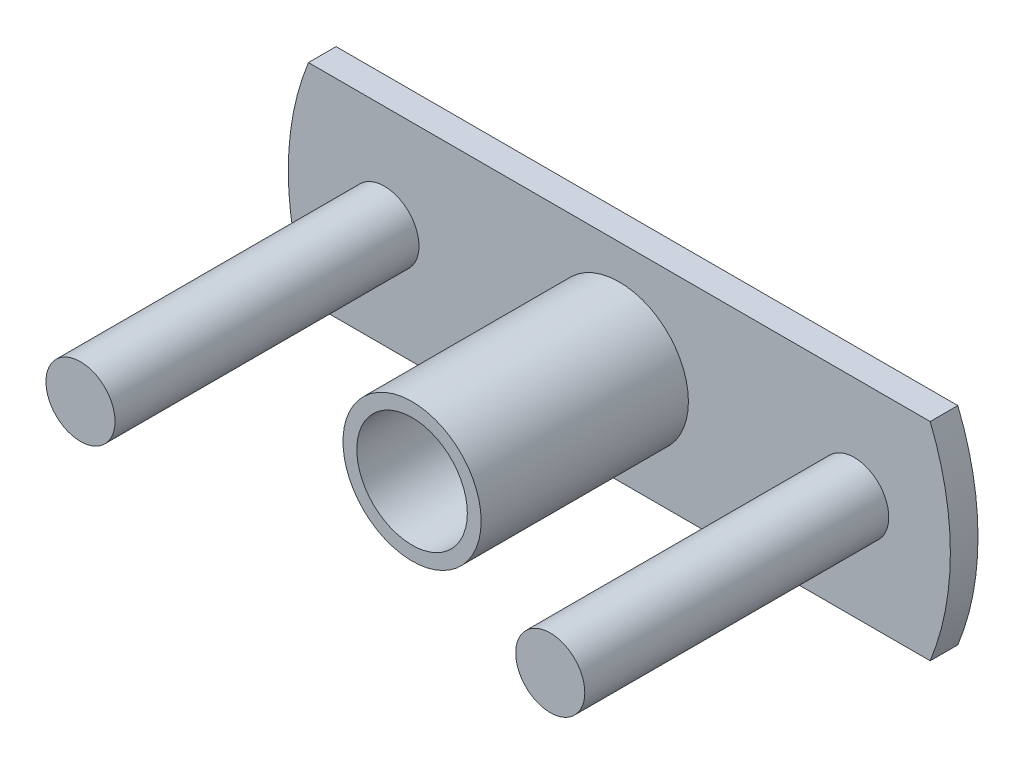
from build123d import *

# Parameters (mm, degrees)
BOSS_EXTRUDE1_DEPTH = 2
SKETCH2_R           = 5
BOSS_EXTRUDE2_DEPTH = 15
SKETCH4_R           = 4
CUT_EXTRUDE1_DEPTH  = 10
SKETCH5_R           = 2.5
BOSS_EXTRUDE3_DEPTH = 22


with BuildPart() as part:
    # Sketch1 → Boss-Extrude1 (new body)
    with BuildSketch(Plane.XY):
        with BuildLine():
            Line((-22.5, -7.5), (22.5, -7.5))
            ThreePointArc((22.5, -7.5), (23.959503782, 0), (22.5, 7.5))
            Line((22.5, 7.5), (-22.5, 7.5))
            ThreePointArc((-22.5, 7.5), (-23.959503782, 0), (-22.5, -7.5))
        make_face()
    extrude(amount=BOSS_EXTRUDE1_DEPTH)

    # Sketch2 → Boss-Extrude2 (add)
    with BuildSketch(Plane.XY.offset(2)):
        Circle(SKETCH2_R)
    extrude(amount=BOSS_EXTRUDE2_DEPTH)

    # Sketch4 → Cut-Extrude1 (cut)
    with BuildSketch(Plane.XY.offset(17)):
        Circle(SKETCH4_R)
    extrude(amount=-CUT_EXTRUDE1_DEPTH, mode=Mode.SUBTRACT)

    # Sketch5 → Boss-Extrude3 (add)
    with BuildSketch(Plane.XY.offset(2)):
        with Locations((-17, 0)):
            Circle(SKETCH5_R)
        with Locations((17, 0)):
            Circle(SKETCH5_R)
    extrude(amount=BOSS_EXTRUDE3_DEPTH)


solid = part.part
